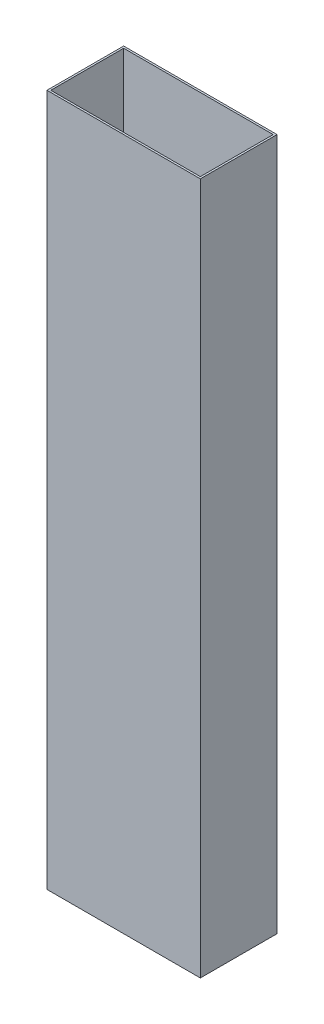
from build123d import *

# Parameters (mm, degrees)
SKETCH1_W           = 203.2
SKETCH1_H           = 101.6
SKETCH1_W_2         = 198.12
SKETCH1_H_2         = 96.52
BOSS_EXTRUDE1_DEPTH = 1526.54
SKETCH2_W           = 99.06
SKETCH2_H           = 609.6
CUT_EXTRUDE1_DEPTH  = 1541.842383763
SKETCH3_W           = 203.2
SKETCH3_H           = 2.54
BOSS_EXTRUDE2_DEPTH = 101.6
CUT_EXTRUDE2_DEPTH  = 1541.928216109


with BuildPart() as part:
    # Sketch1 → Boss-Extrude1 (new body)
    with BuildSketch(Plane(origin=(0, 0, 0), x_dir=(1, 0, 0), z_dir=(0, 1, 0))):
        Rectangle(SKETCH1_W, SKETCH1_H)
        Rectangle(SKETCH1_W_2, SKETCH1_H_2, mode=Mode.SUBTRACT)
    extrude(amount=-BOSS_EXTRUDE1_DEPTH)

    # Sketch2 → Cut-Extrude1 (cut, through all)
    with BuildSketch(Plane(origin=(101.6, 0, 0), x_dir=(0, 0, -1), z_dir=(1, 0, 0))):
        with Locations((-1.27, -1221.74)):
            Rectangle(SKETCH2_W, SKETCH2_H)
    extrude(amount=-CUT_EXTRUDE1_DEPTH, mode=Mode.SUBTRACT)

    # Sketch3 → Boss-Extrude2 (add)
    with BuildSketch(Plane.XY.offset(-48.26)):
        with Locations((0, -1525.27)):
            Rectangle(SKETCH3_W, SKETCH3_H)
    extrude(amount=BOSS_EXTRUDE2_DEPTH)

    # Sketch4 → Cut-Extrude2 (cut, through all)
    with BuildSketch(Plane.ZY.offset(101.6)):
        Polygon((-48.26, -916.94), (-50.8, -916.94), (-50.8, -1526.54), (53.34, -1526.54), (53.34, -1524), (-48.26, -1524), align=None)
    extrude(amount=-CUT_EXTRUDE2_DEPTH, mode=Mode.SUBTRACT)


solid = part.part
